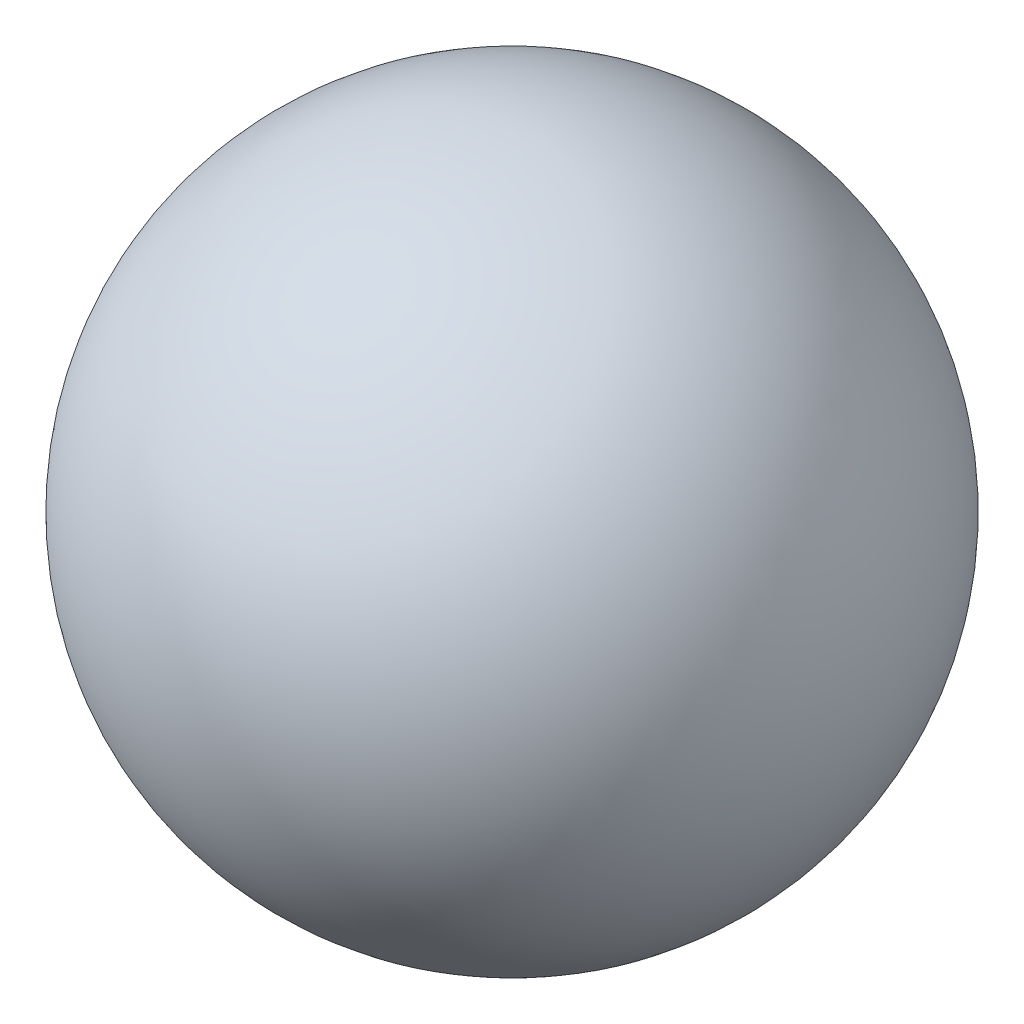
from build123d import *


with BuildPart() as part:
    # Sketch3 → trackball (revolve)
    with BuildSketch(Plane.XY):
        with BuildLine():
            Line((0, 12.7), (0, -12.7))
            ThreePointArc((0, -12.7), (12.7, 0), (0, 12.7))
        make_face()
    revolve(axis=Axis((0, 67.7, 0), (0, -1, 0)))


solid = part.part
